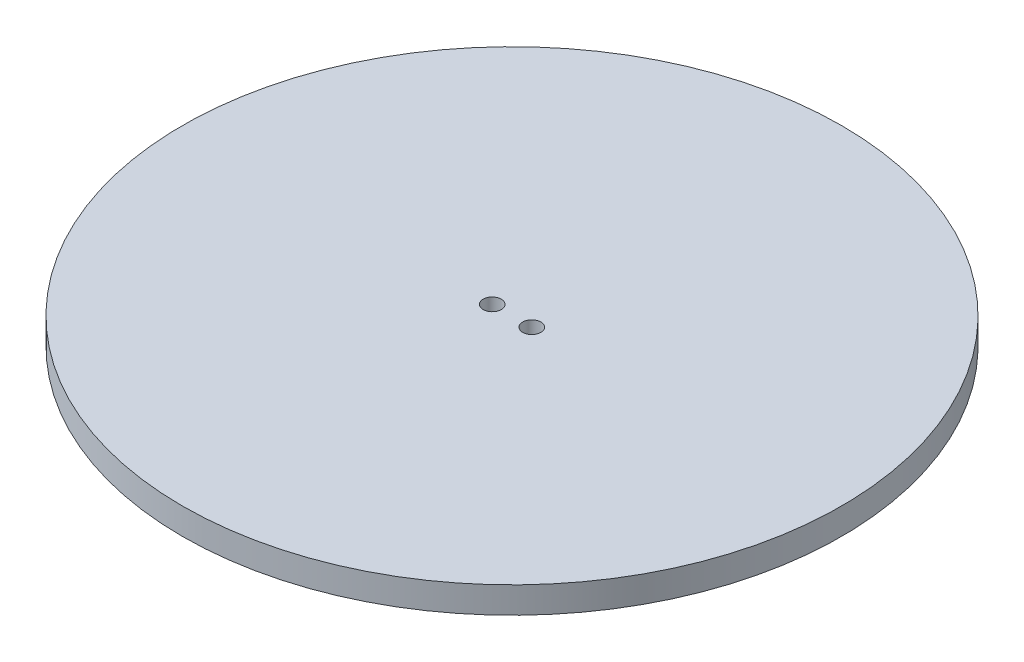
from build123d import *

# Parameters (mm, degrees)
SKETCH1_R           = 100
BOSS_EXTRUDE1_DEPTH = 8
SKETCH2_R           = 2.75
CUT_EXTRUDE1_DEPTH  = 8


with BuildPart() as part:
    # Sketch1 → Boss-Extrude1 (new body)
    with BuildSketch(Plane(origin=(0, 0, 0), x_dir=(1, 0, 0), z_dir=(0, 1, 0))):
        with Locations(Location((0, 0, 0), (0, 0, 270))):
            Circle(SKETCH1_R)
    extrude(amount=BOSS_EXTRUDE1_DEPTH)

    # Sketch2 → Cut-Extrude1 (cut)
    with BuildSketch(Plane(origin=(0, 8, 0), x_dir=(1, 0, 0), z_dir=(0, 1, 0))):
        with Locations(Location((6, 0, 0), (0, 0, 270))):
            Circle(SKETCH2_R)
        with Locations(Location((-6, 0, 0), (0, 0, 270))):
            Circle(SKETCH2_R)
    extrude(amount=-CUT_EXTRUDE1_DEPTH, mode=Mode.SUBTRACT)


solid = part.part
